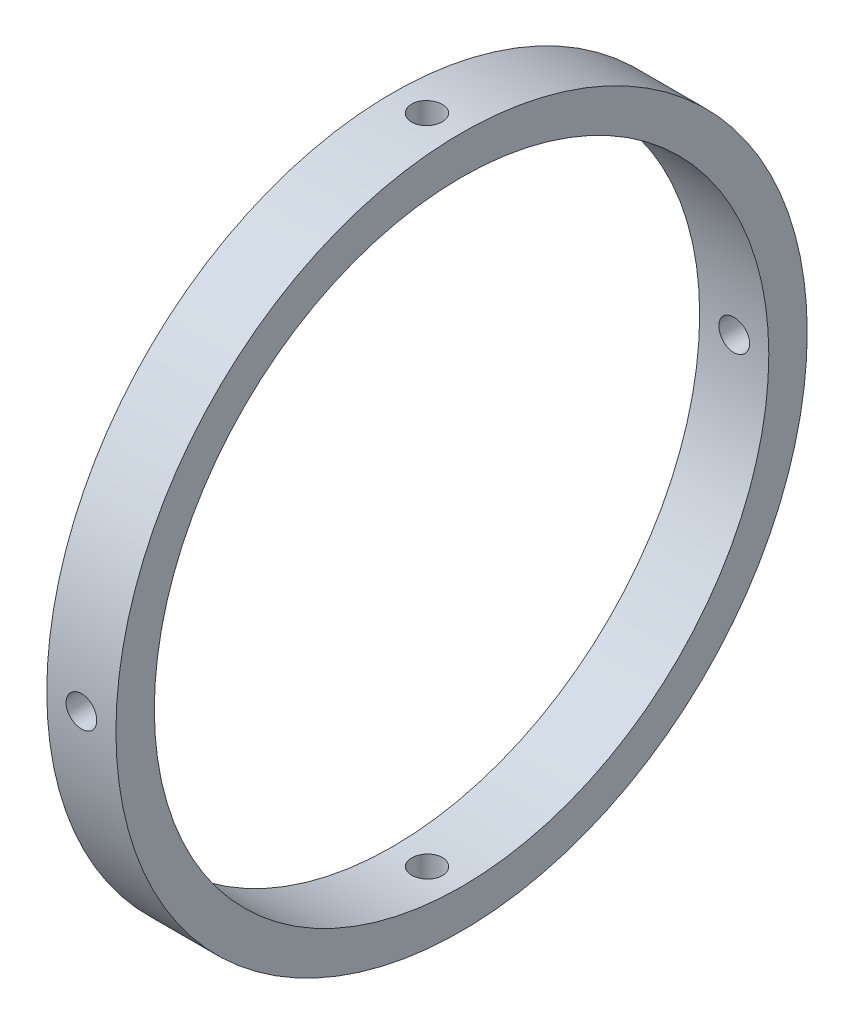
from build123d import *

# Parameters (mm, degrees)
RING_SKETCH_W          = 18
RING_SKETCH_H          = 10
BUSHING_BORE_SKETCH_W  = 4
BUSHING_BORE_SKETCH_H  = 12
BUSHING_BORES_X4_COUNT = 4


with BuildPart() as part:
    # Ring Sketch → Ring (revolve)
    with BuildSketch(Plane.XY, mode=Mode.PRIVATE) as ring_sk:
        with Locations((-48, 85)):
            Rectangle(RING_SKETCH_W, RING_SKETCH_H)
    revolve(ring_sk.sketch.rotate(Axis((-108, 0, 0), (1, 0, 0)), 90), axis=Axis((-108, 0, 0), (1, 0, 0)))

    # Bushing Bore Sketch → Bushing Bore (revolve, cut)
    with BuildSketch(Plane.XY, mode=Mode.PRIVATE) as bushing_bore_sk:
        with Locations((-46, 85)):
            Rectangle(BUSHING_BORE_SKETCH_W, BUSHING_BORE_SKETCH_H)
    bushing_bore = revolve(bushing_bore_sk.sketch.rotate(Axis((-48, 70, 0), (0, 1, 0)), 90), axis=Axis((-48, 70, 0), (0, 1, 0)), mode=Mode.SUBTRACT)

    # Bushing Bores x4: Bushing Bore ×4 about axis
    bushing_bores_x4_axis = Axis((-38.1, 0, 0), (-1, 0, 0))
    for i in range(1, BUSHING_BORES_X4_COUNT):
        add(bushing_bore.rotate(bushing_bores_x4_axis, i * 360 / BUSHING_BORES_X4_COUNT), mode=Mode.SUBTRACT)


solid = part.part
